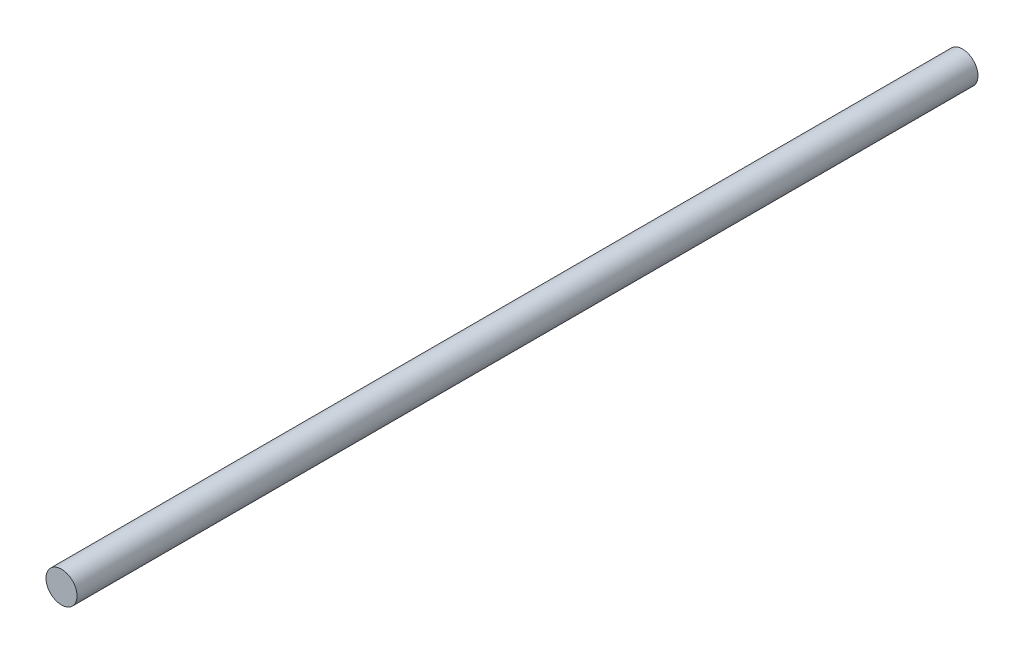
from build123d import *

# Parameters (mm, degrees)
SKETCH1_R           = 5
BOSS_EXTRUDE1_DEPTH = 290


with BuildPart() as part:
    # Sketch1 → Boss-Extrude1 (new body)
    with BuildSketch(Plane.XY):
        Circle(SKETCH1_R)
    extrude(amount=BOSS_EXTRUDE1_DEPTH)


solid = part.part
